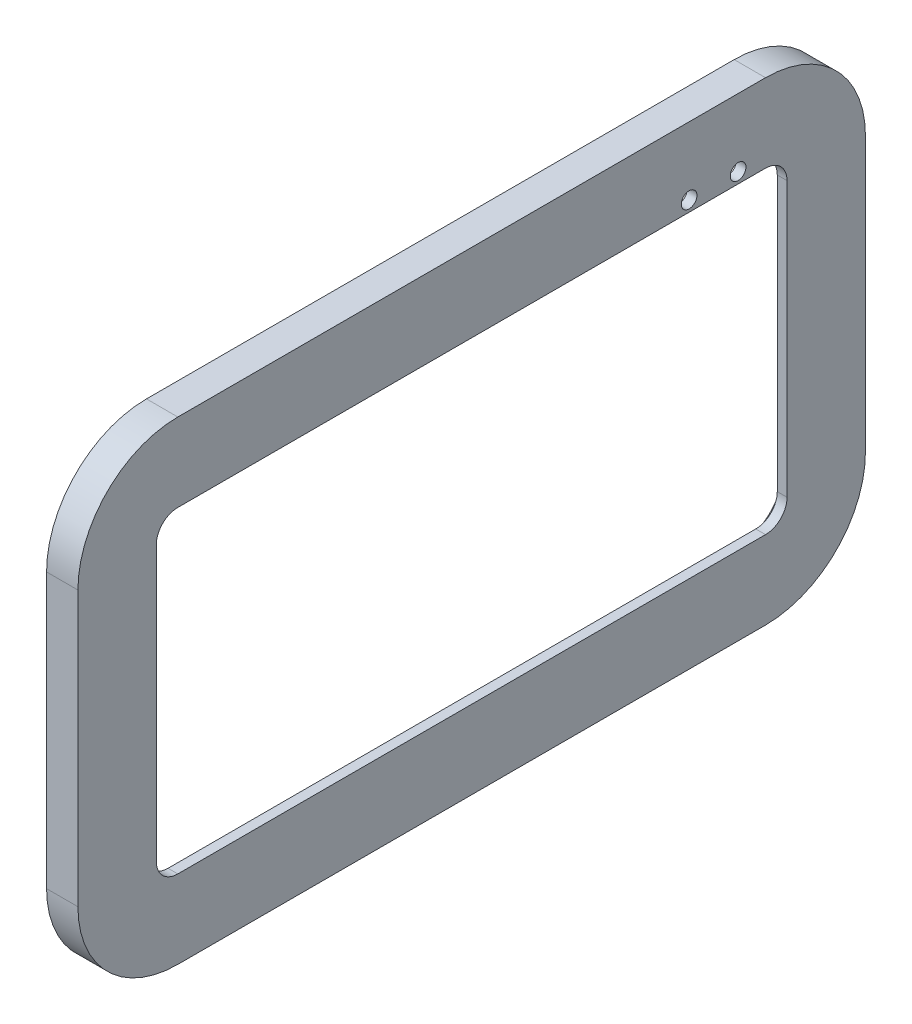
from build123d import *

# Parameters (mm, degrees)
BOSS_EXTRUDE1_DEPTH       = 16
CUT_EXTRUDE3_DEPTH        = 11
SKETCH3_R                 = 4
CUT_EXTRUDE1_DEPTH        = 236.155267855
F_8_0MM_DOWEL_HOLE1_D     = 8
F_8_0MM_DOWEL_HOLE1_DEPTH = 12
F_8_0MM_DOWEL_HOLE1_TIP   = 2.403442476


with BuildPart() as part:
    # Sweep1: sweep along a path in Sketch2
    with BuildLine(Plane(origin=(0, 0, 0), x_dir=(0, 0, -1), z_dir=(1, 0, 0))) as sweep1_path:
        Line((150, 92), (-150, 92))
        ThreePointArc((-150, 92), (-165.556349186, 85.556349186), (-172, 70))
        Line((-172, 70), (-172, -70))
        ThreePointArc((-172, -70), (-165.556349186, -85.556349186), (-150, -92))
        Line((-150, -92), (150, -92))
        ThreePointArc((150, -92), (165.556349186, -85.556349186), (172, -70))
        Line((172, -70), (172, 70))
        ThreePointArc((172, 70), (165.556349186, 85.556349186), (150, 92))
    # Sketch1 → Sweep1 (sweep)
    with BuildSketch(Plane.XY):
        Polygon((-3, 96), (-3, 121), (13, 121), (13, 81), (8, 81), (8, 96), align=None)
    sweep(path=sweep1_path.line)

    # Sketch5 → Boss-Extrude1 (add)
    with BuildSketch(Plane(origin=(13, 0, 0), x_dir=(0, 0, -1), z_dir=(1, 0, 0))):
        with BuildLine():
            Line((201, 70), (201, -70))
            ThreePointArc((201, -70), (186.062445841, -106.062445841), (150, -121))
            Line((150, -121), (-150, -121))
            ThreePointArc((-150, -121), (-186.062445841, -106.062445841), (-201, -70))
            Line((-201, -70), (-201, 70))
            ThreePointArc((-201, 70), (-186.062445841, 106.062445841), (-150, 121))
            Line((-150, 121), (150, 121))
            ThreePointArc((150, 121), (186.062445841, 106.062445841), (201, 70))
        make_face()
        with BuildLine():
            Line((-161, -70), (-161, 70))
            ThreePointArc((-161, 70), (-157.778174593, 77.778174593), (-150, 81))
            Line((-150, 81), (150, 81))
            ThreePointArc((150, 81), (157.778174593, 77.778174593), (161, 70))
            Line((161, 70), (161, -70))
            ThreePointArc((161, -70), (157.778174593, -77.778174593), (150, -81))
            Line((150, -81), (-150, -81))
            ThreePointArc((-150, -81), (-157.778174593, -77.778174593), (-161, -70))
        make_face(mode=Mode.SUBTRACT)
    extrude(amount=-BOSS_EXTRUDE1_DEPTH)

    # Sketch6 → Cut-Extrude3 (cut)
    with BuildSketch(Plane.ZY.offset(3)):
        with BuildLine():
            Line((176, -70), (176, 70))
            ThreePointArc((176, 70), (168.384776311, 88.384776311), (150, 96))
            Line((150, 96), (-150, 96))
            ThreePointArc((-150, 96), (-168.384776311, 88.384776311), (-176, 70))
            Line((-176, 70), (-176, -70))
            ThreePointArc((-176, -70), (-168.384776311, -88.384776311), (-150, -96))
            Line((-150, -96), (150, -96))
            ThreePointArc((150, -96), (168.384776311, -88.384776311), (176, -70))
        make_face()
    extrude(amount=-CUT_EXTRUDE3_DEPTH, mode=Mode.SUBTRACT)

    # Sketch3 → Cut-Extrude1 (cut, through all)
    with BuildSketch(Plane(origin=(13, 0, 0), x_dir=(0, 0, -1), z_dir=(1, 0, 0))):
        with Locations(Location((111, 86.5, 0), (0, 0, 90))):
            Circle(SKETCH3_R)
        with Locations(Location((136, 86.5, 0), (0, 0, 90))):
            Circle(SKETCH3_R)
    extrude(amount=-CUT_EXTRUDE1_DEPTH, mode=Mode.SUBTRACT)

    # Ø8.0mm Dowel Hole1
    with Locations(Plane(origin=(-3, 0, -188.5), x_dir=(0, -1, 0), z_dir=(-1, 0, 0))):
        with Locations((0, 0), (0, 377)):
            Hole(F_8_0MM_DOWEL_HOLE1_D / 2, depth=F_8_0MM_DOWEL_HOLE1_DEPTH)
            with Locations((0, 0, -(F_8_0MM_DOWEL_HOLE1_DEPTH + F_8_0MM_DOWEL_HOLE1_TIP / 2))):  # 118° drill point
                Cone(0, F_8_0MM_DOWEL_HOLE1_D / 2, F_8_0MM_DOWEL_HOLE1_TIP, mode=Mode.SUBTRACT)


solid = part.part
